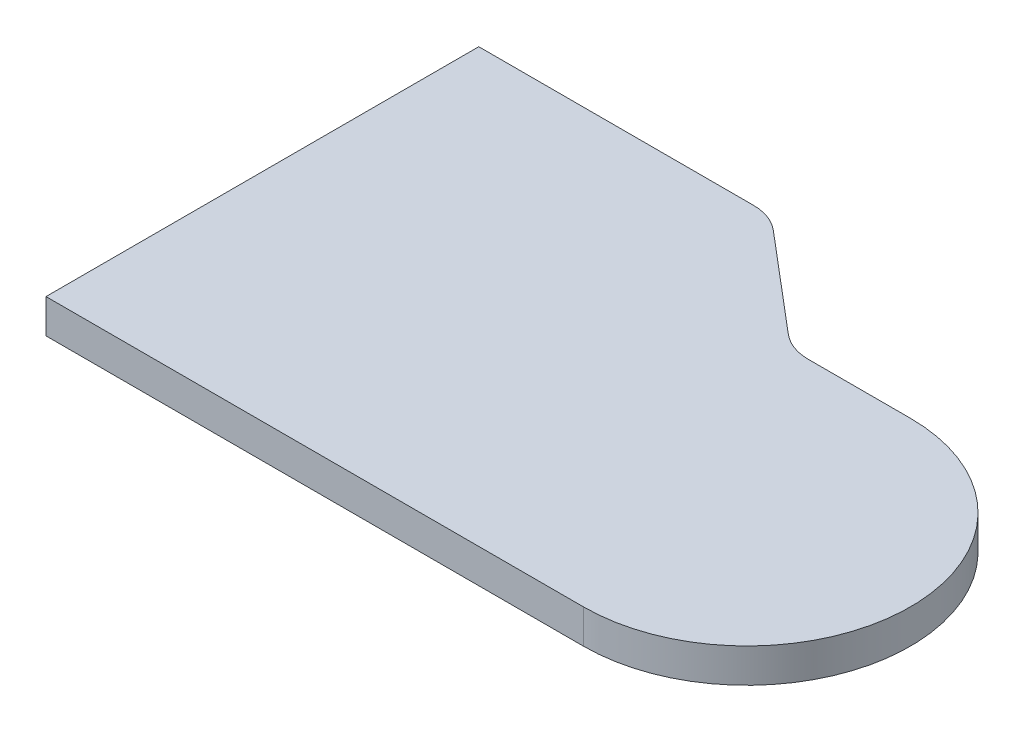
from build123d import *

# Parameters (mm, degrees)
EXTRUDE2_DEPTH = 4.445


with BuildPart() as part:
    # Sketch1 → Extrude2 (new body)
    with BuildSketch(Plane(origin=(0, 0, 0), x_dir=(1, 0, 0), z_dir=(0, 1, 0))):
        with BuildLine():
            Line((0, 0), (70.128669853, 0))
            ThreePointArc((70.128669853, 0), (91.447571558, 21.318901704), (70.128669853, 42.637803409))
            Line((70.128669853, 42.637803409), (56.809824029, 42.637803409))
            ThreePointArc((56.809824029, 42.637803409), (54.625693022, 43.025247602), (52.708090795, 44.140300497))
            Line((52.708090795, 44.140300497), (39.921942966, 54.95934866))
            ThreePointArc((39.921942966, 54.95934866), (38.004340739, 56.074401554), (35.820209733, 56.461845748))
            Line((35.820209733, 56.461845748), (0, 56.461845748))
            Line((0, 56.461845748), (0, 0))
        make_face()
    extrude(amount=-EXTRUDE2_DEPTH)


solid = part.part
